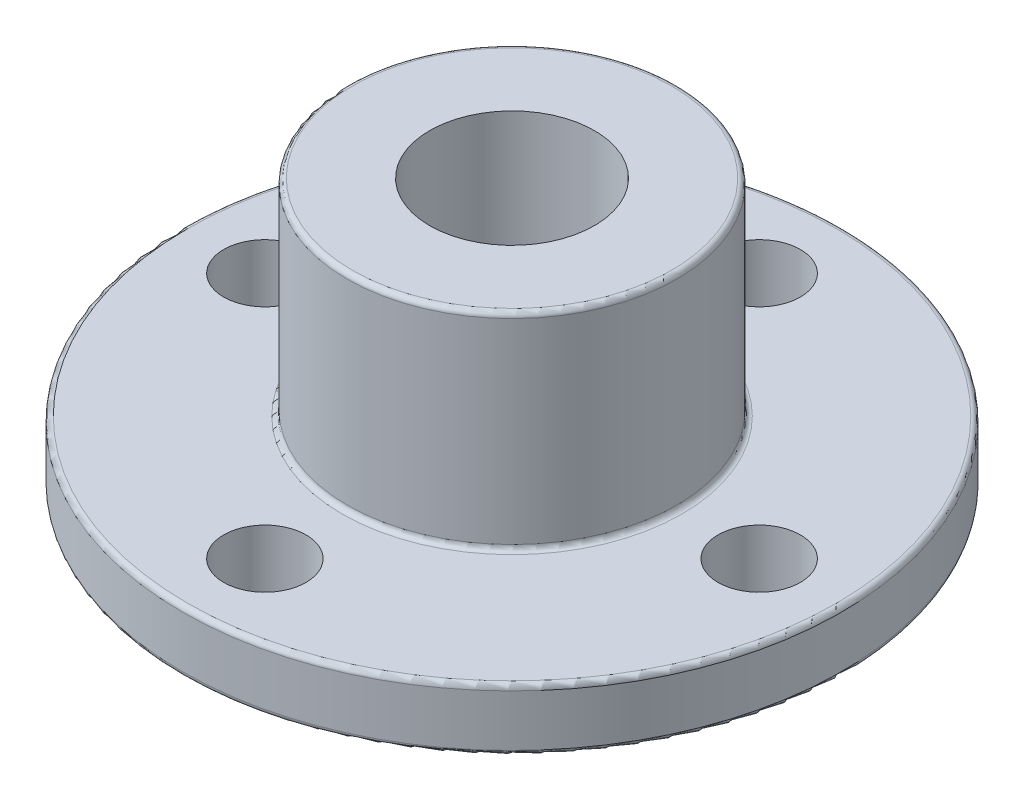
from build123d import *

# Parameters (mm, degrees)
SKETCH1_R           = 16
BOSS_EXTRUDE1_DEPTH = 3
FILLET1_R           = 0.25
SKETCH2_R           = 8
BOSS_EXTRUDE2_DEPTH = 10
FILLET2_R           = 0.25
CUT_EXTRUDE1_REACH  = 28.096
SKETCH3_R           = 4
CUT_EXTRUDE2_REACH  = 26.739
SKETCH4_R           = 2


with BuildPart() as part:
    # Sketch1 → Boss-Extrude1 (new body)
    with BuildSketch(Plane(origin=(0, 0, 0), x_dir=(1, 0, 0), z_dir=(0, 1, 0))):
        with Locations(Location((0, 0, 0), (0, 0, 270))):
            Circle(SKETCH1_R)
    extrude(amount=BOSS_EXTRUDE1_DEPTH)

    # Fillet1
    fillet1_edges = [part.edges().sort_by_distance(p)[0] for p in [
        (0, 0, -16),
        (0, 3, -16),
    ]]
    fillet(fillet1_edges, radius=FILLET1_R)

    # Sketch2 → Boss-Extrude2 (add)
    with BuildSketch(Plane(origin=(0, 3, 0), x_dir=(1, 0, 0), z_dir=(0, 1, 0))):
        with Locations(Location((0, 0, 0), (0, 0, 270))):
            Circle(SKETCH2_R)
    extrude(amount=BOSS_EXTRUDE2_DEPTH)

    # Fillet2
    fillet2_edges = [part.edges().sort_by_distance(p)[0] for p in [
        (0, 3, -8),
        (0, 13, -8),
    ]]
    fillet(fillet2_edges, radius=FILLET2_R)

    # Sketch3 → Cut-Extrude1 (cut, up to next)
    with BuildSketch(Plane(origin=(0, 13, 0), x_dir=(1, 0, 0), z_dir=(0, 1, 0)), mode=Mode.PRIVATE) as cut_extrude1_sk1:
        with Locations(Location((0, 0, 0), (0, 0, 270))):
            Circle(SKETCH3_R)
    cut_extrude1_tool1 = extrude(cut_extrude1_sk1.sketch, amount=-CUT_EXTRUDE1_REACH, mode=Mode.PRIVATE) & part.part
    add(cut_extrude1_tool1.solids().sort_by_distance((0, 13, 0))[0], mode=Mode.SUBTRACT)

    # Sketch4 → Cut-Extrude2 (cut, up to next)
    with BuildSketch(Plane(origin=(0, 3, 0), x_dir=(1, 0, 0), z_dir=(0, 1, 0)), mode=Mode.PRIVATE) as cut_extrude2_sk1:
        with Locations(Location((0, 12, 0), (0, 0, 270))):
            Circle(SKETCH4_R)
    cut_extrude2_tool1 = extrude(cut_extrude2_sk1.sketch, amount=-CUT_EXTRUDE2_REACH, mode=Mode.PRIVATE) & part.part
    # Sketch4 → Cut-Extrude2 (cut, up to next)
    with BuildSketch(Plane(origin=(0, 3, 0), x_dir=(1, 0, 0), z_dir=(0, 1, 0)), mode=Mode.PRIVATE) as cut_extrude2_sk2:
        with Locations(Location((-12, 0, 0), (0, 0, 270))):
            Circle(SKETCH4_R)
    cut_extrude2_tool2 = extrude(cut_extrude2_sk2.sketch, amount=-CUT_EXTRUDE2_REACH, mode=Mode.PRIVATE) & part.part
    # Sketch4 → Cut-Extrude2 (cut, up to next)
    with BuildSketch(Plane(origin=(0, 3, 0), x_dir=(1, 0, 0), z_dir=(0, 1, 0)), mode=Mode.PRIVATE) as cut_extrude2_sk3:
        with Locations(Location((0, -12, 0), (0, 0, 270))):
            Circle(SKETCH4_R)
    cut_extrude2_tool3 = extrude(cut_extrude2_sk3.sketch, amount=-CUT_EXTRUDE2_REACH, mode=Mode.PRIVATE) & part.part
    # Sketch4 → Cut-Extrude2 (cut, up to next)
    with BuildSketch(Plane(origin=(0, 3, 0), x_dir=(1, 0, 0), z_dir=(0, 1, 0)), mode=Mode.PRIVATE) as cut_extrude2_sk4:
        with Locations(Location((12, 0, 0), (0, 0, 270))):
            Circle(SKETCH4_R)
    cut_extrude2_tool4 = extrude(cut_extrude2_sk4.sketch, amount=-CUT_EXTRUDE2_REACH, mode=Mode.PRIVATE) & part.part
    add(cut_extrude2_tool1.solids().sort_by_distance((0, 3, -12))[0], mode=Mode.SUBTRACT)
    add(cut_extrude2_tool2.solids().sort_by_distance((-12, 3, 0))[0], mode=Mode.SUBTRACT)
    add(cut_extrude2_tool3.solids().sort_by_distance((0, 3, 12))[0], mode=Mode.SUBTRACT)
    add(cut_extrude2_tool4.solids().sort_by_distance((12, 3, 0))[0], mode=Mode.SUBTRACT)


solid = part.part
